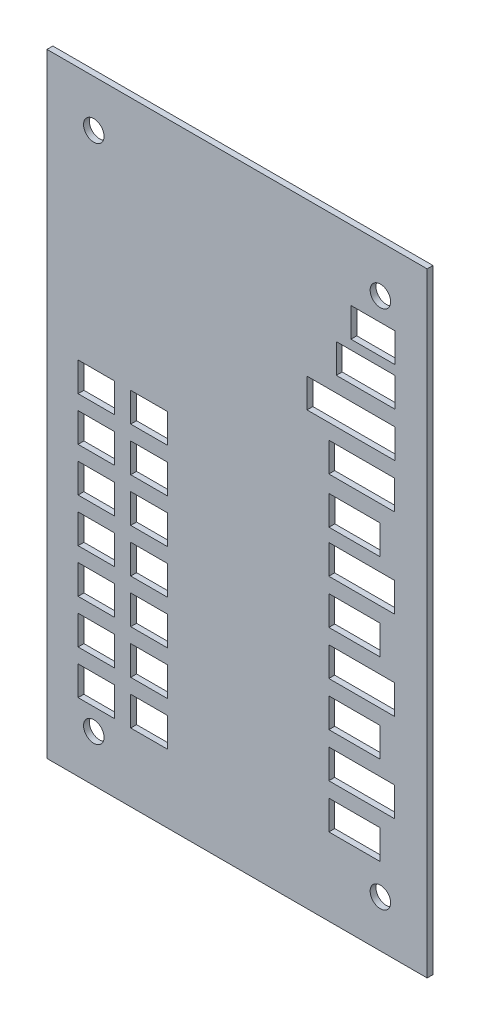
from build123d import *

# Parameters (mm, degrees)
SKETCH_1_W          = 54.99998652
SKETCH_1_H          = 95.00001066
EXTRUDE_1_DEPTH     = 1
SKETCH_3_W          = 7.5000204
SKETCH_3_H          = 5
SKETCH_3_W_2        = 9.99999
SKETCH_3_W_3        = 14.99998
SKETCH_3_W_4        = 11.2500256
SKETCH_3_W_5        = 8.7500052
SKETCH_3_W_6        = 6.2500356
SKETCH_3_W_7        = 6.2499848
CUT_EXTRUDE_1_DEPTH = 1
SKETCH_7_R          = 1.75
CUT_EXTRUDE_4_DEPTH = 1
SKETCH_8_W          = 54.99998652
SKETCH_8_H          = 1
EXTRUDE_2_DEPTH     = 5
SKETCH_9_W          = 54.99998652
SKETCH_9_H          = 1
EXTRUDE_3_DEPTH     = 5
SKETCH_10_W         = 1
SKETCH_10_H         = 105.00001066
EXTRUDE_4_DEPTH     = 5
SKETCH_11_W         = 1
SKETCH_11_H         = 105.00001066
EXTRUDE_5_DEPTH     = 5


with BuildPart() as part:
    # 草图1 → 凸台-拉伸1 (new body)
    with BuildSketch(Plane.XY):
        with Locations((52.49999406, 77.49999359)):
            Rectangle(SKETCH_1_W, SKETCH_1_H)
    extrude(amount=EXTRUDE_1_DEPTH)

    # 草图3 → 切除-拉伸1 (cut)
    with BuildSketch(Plane.XY.offset(1)):
        with Locations((75.7119898, 115.57)):
            Rectangle(SKETCH_3_W, SKETCH_3_H)
        with Locations((74.462005, 108.966)):
            Rectangle(SKETCH_3_W_2, SKETCH_3_H)
        with Locations((71.96201254, 101.346)):
            Rectangle(SKETCH_3_W_3, SKETCH_3_H)
        with Locations((73.8089964, 93.726)):
            Rectangle(SKETCH_3_W_4, SKETCH_3_H)
        with Locations((72.5790014, 85.852)):
            Rectangle(SKETCH_3_W_5, SKETCH_3_H)
        with Locations((73.8089964, 78.5831296)):
            Rectangle(SKETCH_3_W_4, SKETCH_3_H)
        with Locations((72.5680286, 71.0116944)):
            Rectangle(SKETCH_3_W_5, SKETCH_3_H)
        with Locations((73.8089964, 63.44031)):
            Rectangle(SKETCH_3_W_4, SKETCH_3_H)
        with Locations((72.5680286, 55.8688748)):
            Rectangle(SKETCH_3_W_5, SKETCH_3_H)
        with Locations((73.8089964, 48.2974396)):
            Rectangle(SKETCH_3_W_4, SKETCH_3_H)
        with Locations((72.5680286, 40.7260044)):
            Rectangle(SKETCH_3_W_5, SKETCH_3_H)
        with Locations((37.440997, 84.1740252)):
            Rectangle(SKETCH_3_W_6, SKETCH_3_H)
        with Locations((28.4409896, 84.1740252)):
            Rectangle(SKETCH_3_W_7, SKETCH_3_H)
        with Locations((37.440997, 76.6740148)):
            Rectangle(SKETCH_3_W_6, SKETCH_3_H)
        with Locations((28.4409896, 76.6740148)):
            Rectangle(SKETCH_3_W_7, SKETCH_3_H)
        with Locations((37.440997, 69.1740044)):
            Rectangle(SKETCH_3_W_6, SKETCH_3_H)
        with Locations((28.4409896, 69.1740044)):
            Rectangle(SKETCH_3_W_7, SKETCH_3_H)
        with Locations((37.440997, 61.673994)):
            Rectangle(SKETCH_3_W_6, SKETCH_3_H)
        with Locations((28.4409896, 61.673994)):
            Rectangle(SKETCH_3_W_7, SKETCH_3_H)
        with Locations((37.440997, 54.1739836)):
            Rectangle(SKETCH_3_W_6, SKETCH_3_H)
        with Locations((28.4409896, 54.1739836)):
            Rectangle(SKETCH_3_W_7, SKETCH_3_H)
        with Locations((37.440997, 46.674024)):
            Rectangle(SKETCH_3_W_6, SKETCH_3_H)
        with Locations((28.4409896, 46.674024)):
            Rectangle(SKETCH_3_W_7, SKETCH_3_H)
        with Locations((37.440997, 39.1740136)):
            Rectangle(SKETCH_3_W_6, SKETCH_3_H)
        with Locations((28.4409896, 39.1740136)):
            Rectangle(SKETCH_3_W_7, SKETCH_3_H)
    extrude(amount=-CUT_EXTRUDE_1_DEPTH, mode=Mode.SUBTRACT)

    # 草图7 → 切除-拉伸4 (cut)
    with BuildSketch(Plane.XY.offset(1)):
        with Locations((77.00000094, 121.99999984)):
            Circle(SKETCH_7_R)
        with Locations((27.99999988, 121.99999984)):
            Circle(SKETCH_7_R)
        with Locations((77.00000094, 33.00000004)):
            Circle(SKETCH_7_R)
        with Locations((27.9999948, 32.9999848)):
            Circle(SKETCH_7_R)
    extrude(amount=-CUT_EXTRUDE_4_DEPTH, mode=Mode.SUBTRACT)

    # 草图8 → 凸台-拉伸2 (add)
    with BuildSketch(Plane(origin=(0, 124.99999892, 0), x_dir=(1, 0, 0), z_dir=(0, 1, 0))):
        with Locations((52.49999406, -0.5)):
            Rectangle(SKETCH_8_W, SKETCH_8_H)
    extrude(amount=EXTRUDE_2_DEPTH)

    # 草图9 → 凸台-拉伸3 (add)
    with BuildSketch(Plane.XZ.offset(-29.99998826)):
        with Locations((52.49999406, 0.5)):
            Rectangle(SKETCH_9_W, SKETCH_9_H)
    extrude(amount=EXTRUDE_3_DEPTH)

    # 草图10 → 凸台-拉伸4 (add)
    with BuildSketch(Plane.ZY.offset(-25.0000008)):
        with Locations((0.5, 77.49999359)):
            Rectangle(SKETCH_10_W, SKETCH_10_H)
    extrude(amount=EXTRUDE_4_DEPTH)

    # 草图11 → 凸台-拉伸5 (add)
    with BuildSketch(Plane(origin=(79.99998732, 0, 0), x_dir=(0, 0, -1), z_dir=(1, 0, 0))):
        with Locations((-0.5, 77.49999359)):
            Rectangle(SKETCH_11_W, SKETCH_11_H)
    extrude(amount=EXTRUDE_5_DEPTH)


solid = part.part
